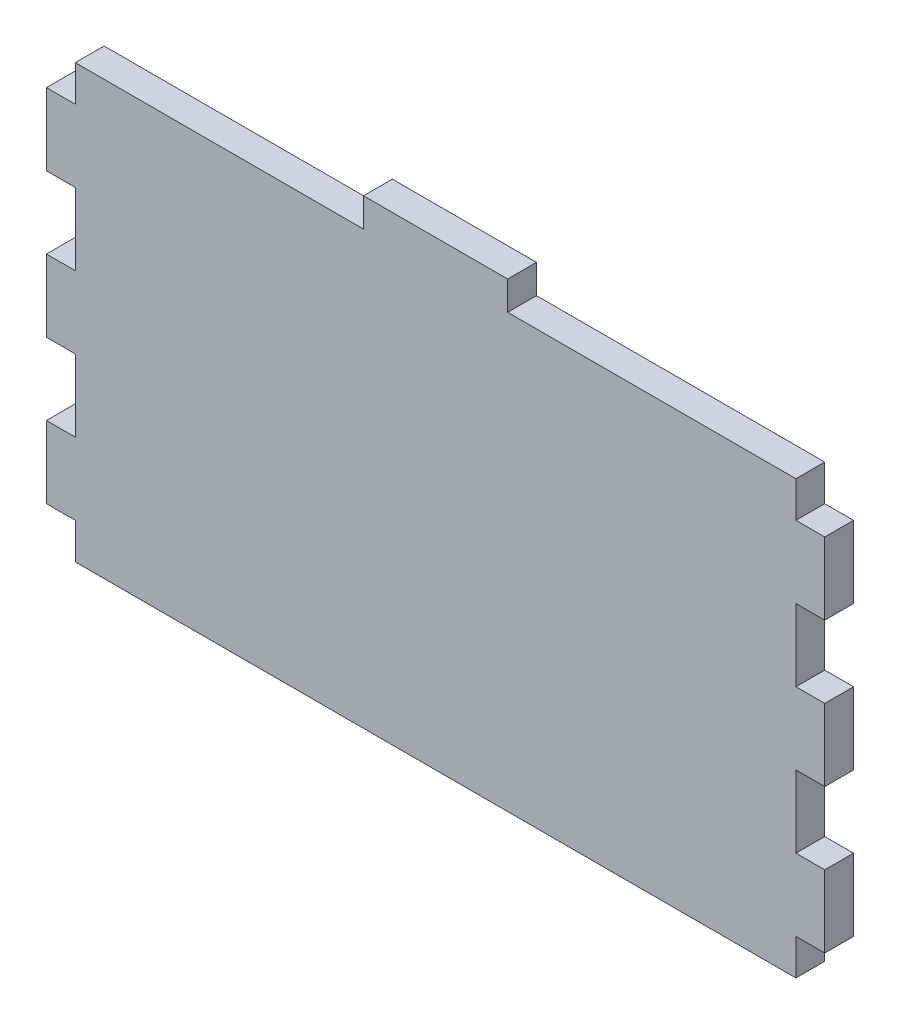
from build123d import *

# Parameters (mm, degrees)
BOSS_EXTRUDE1_DEPTH = 4
SKETCH2_W           = 20
SKETCH2_H           = 8
BOSS_EXTRUDE2_DEPTH = 4


with BuildPart() as part:
    # Sketch1 → Boss-Extrude1 (new body)
    with BuildSketch(Plane.XY):
        Polygon((-50, 30), (-50, 25), (-54, 25), (-54, 15), (-50, 15), (-50, 5), (-54, 5), (-54, -5), (-50, -5), (-50, -15), (-54, -15), (-54, -25), (-50, -25), (-50, -30), (50, -30), (50, -25), (54, -25), (54, -15), (50, -15), (50, -5), (54, -5), (54, 5), (50, 5), (50, 15), (54, 15), (54, 25), (50, 25), (50, 30), align=None)
    extrude(amount=BOSS_EXTRUDE1_DEPTH)

    # Sketch2 → Boss-Extrude2 (add)
    with BuildSketch(Plane.XY.offset(4)):
        with Locations((0, 30)):
            Rectangle(SKETCH2_W, SKETCH2_H)
    extrude(amount=-BOSS_EXTRUDE2_DEPTH)


solid = part.part
